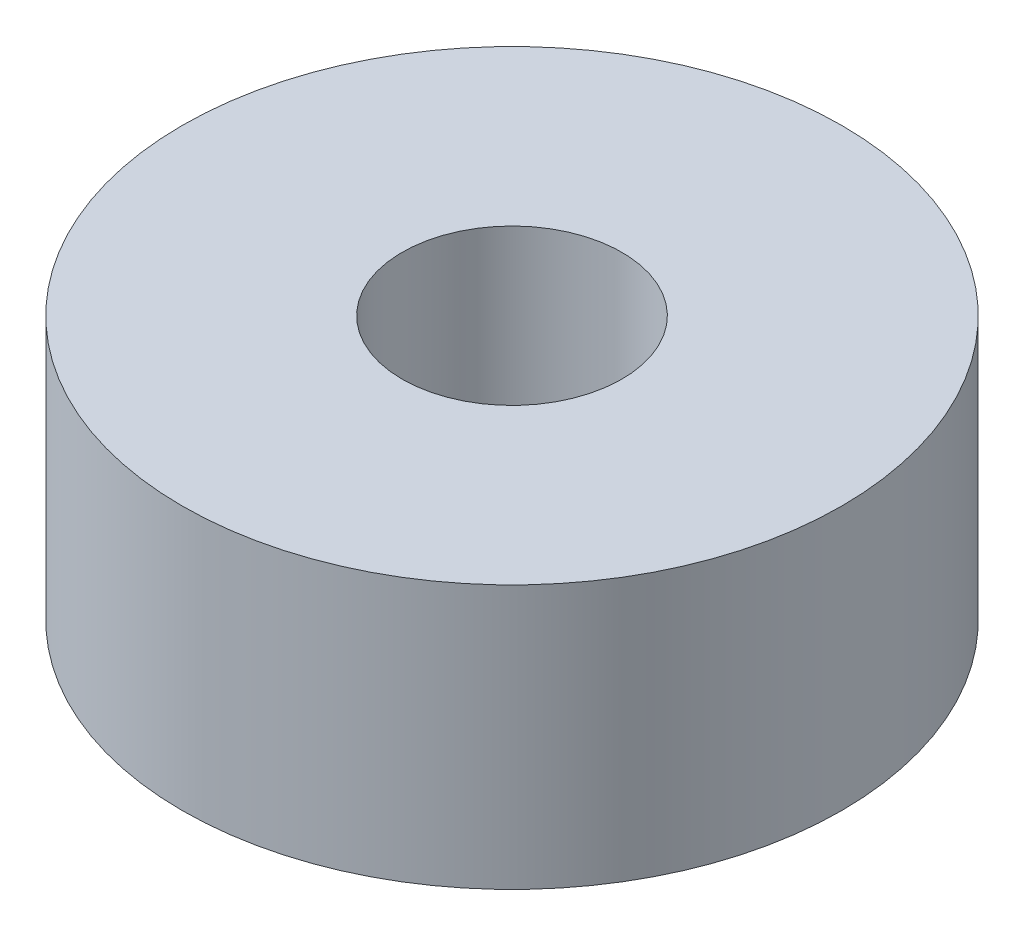
from build123d import *

# Parameters (mm, degrees)
SZKIC1_R                    = 7.5
SZKIC1_R_2                  = 2.5
DODANIE_WYCI_GNI_CIE1_DEPTH = 6


with BuildPart() as part:
    # Szkic1 → Dodanie-wyciągnięcie1 (new body)
    with BuildSketch(Plane(origin=(0, 0, 0), x_dir=(1, 0, 0), z_dir=(0, 1, 0))):
        with Locations(Location((0, 0, 0), (0, 0, 270))):
            Circle(SZKIC1_R)
        with Locations(Location((0, 0, 0), (0, 0, 270))):
            Circle(SZKIC1_R_2, mode=Mode.SUBTRACT)
    extrude(amount=DODANIE_WYCI_GNI_CIE1_DEPTH)


solid = part.part
